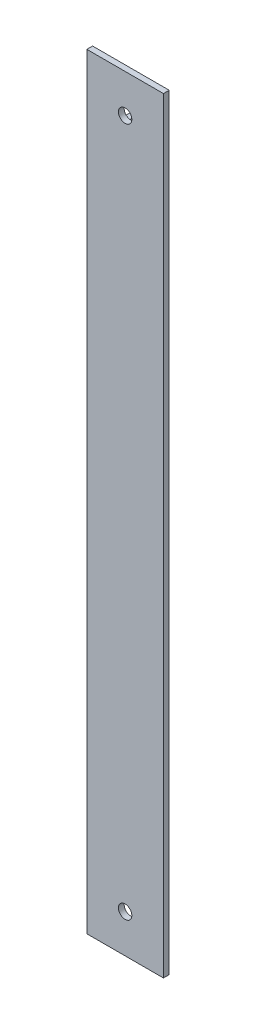
from build123d import *

# Parameters (mm, degrees)
EXTRUDE_1_DEPTH     = 200
SKETCH_2_W          = 1.5
SKETCH_2_H          = 18.5
CUT_EXTRUDE_1_DEPTH = 20
CUT_EXTRUDE_2_REACH = 203.99
SKETCH_3_R          = 1.75


with BuildPart() as part:
    # Эскиз1 → Бобышка-Вытянуть1 (new body)
    with BuildSketch(Plane(origin=(0, 0, 0), x_dir=(1, 0, 0), z_dir=(0, 1, 0))):
        Polygon((0, 0), (0, 20), (1.5, 20), (1.5, 1.5), (20, 1.5), (20, 0), align=None)
    extrude(amount=EXTRUDE_1_DEPTH)

    # Эскиз2 → Вырез-Вытянуть1 (cut)
    with BuildSketch(Plane(origin=(0, 200, 0), x_dir=(1, 0, 0), z_dir=(0, 1, 0))):
        with Locations((0.75, 10.75)):
            Rectangle(SKETCH_2_W, SKETCH_2_H)
    cut_extrude_1 = extrude(amount=-CUT_EXTRUDE_1_DEPTH, mode=Mode.SUBTRACT)

    # Эскиз3 → Вырез-Вытянуть2 (cut, up to next)
    with BuildSketch(Plane.XY, mode=Mode.PRIVATE) as cut_extrude_2_sk1:
        with Locations((10, 190)):
            Circle(SKETCH_3_R)
    cut_extrude_2_tool1 = extrude(cut_extrude_2_sk1.sketch, amount=-CUT_EXTRUDE_2_REACH, mode=Mode.PRIVATE) & part.part
    cut_extrude_2 = cut_extrude_2_tool1.solids().sort_by_distance((10, 190, 0))[0]
    add(cut_extrude_2, mode=Mode.SUBTRACT)

    # Зеркальное отражение1: Вырез-Вытянуть1, Вырез-Вытянуть2 across plane
    add(cut_extrude_1.mirror(Plane(origin=(0, 100, 0), x_dir=(0, 0, 1), z_dir=(0, -1, 0))), mode=Mode.SUBTRACT)
    add(cut_extrude_2.mirror(Plane(origin=(0, 100, 0), x_dir=(0, 0, 1), z_dir=(0, -1, 0))), mode=Mode.SUBTRACT)


solid = part.part
